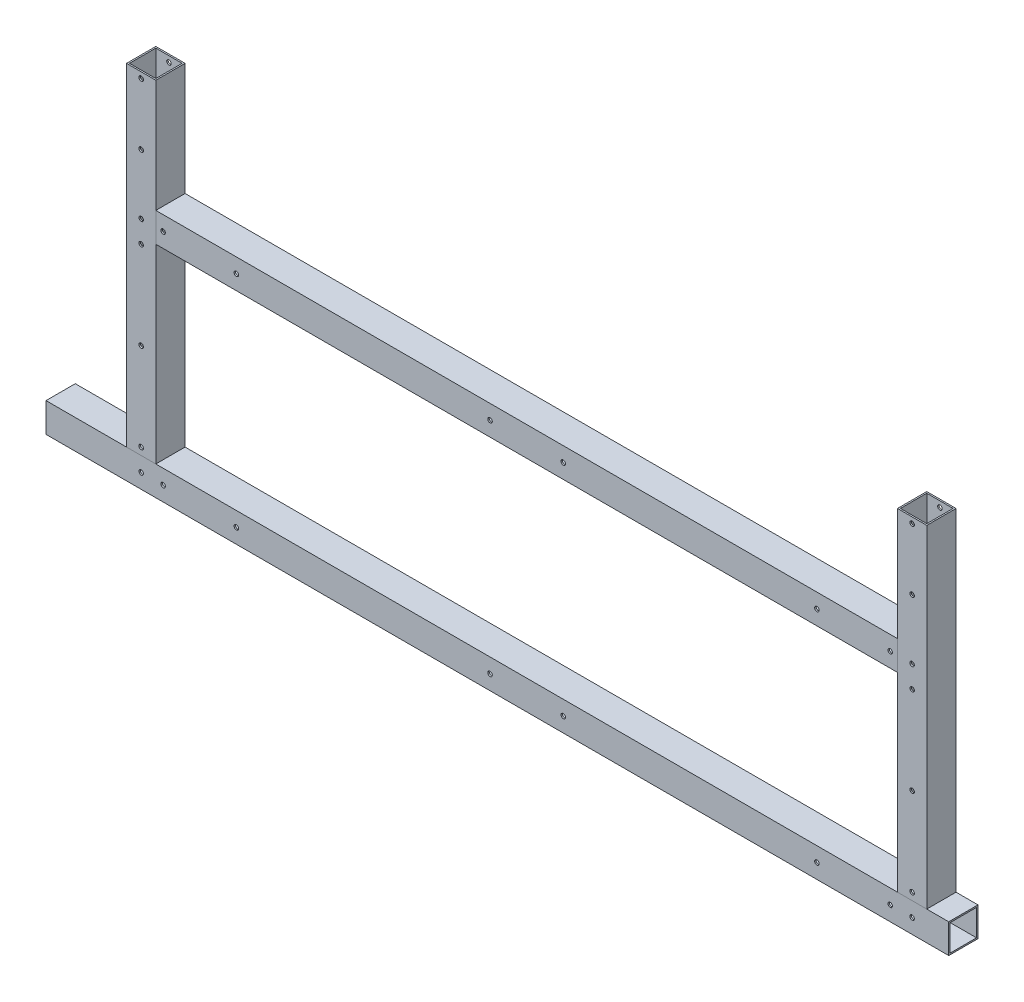
from build123d import *

# Parameters (mm, degrees)
F_20X20X1_1_DEPTH         = 237
F_20X20X1_1_DEPTH_BACK    = 1
SKETCH_1_W                = 20
SKETCH_1_H                = 20
SKETCH_1_W_2              = 18
SKETCH_1_H_2              = 18
SKETCH_1_ON_SEGMENT_2_W   = 20
SKETCH_1_ON_SEGMENT_2_H   = 20
SKETCH_1_ON_SEGMENT_2_W_2 = 18
SKETCH_1_ON_SEGMENT_2_H_2 = 18
F_20X20X1_1_2_DEPTH       = 528.6
SKETCH_1_ON_SEGMENT_3_W   = 20
SKETCH_1_ON_SEGMENT_3_H   = 20
SKETCH_1_ON_SEGMENT_3_W_2 = 18
SKETCH_1_ON_SEGMENT_3_H_2 = 18
F_20X20X1_1_3_DEPTH       = 238
SKETCH_1_ON_SEGMENT_4_W   = 20
SKETCH_1_ON_SEGMENT_4_H   = 20
SKETCH_1_ON_SEGMENT_4_W_2 = 18
SKETCH_1_ON_SEGMENT_4_H_2 = 18
F_20X20X1_1_4_DEPTH       = 616.6
SKETCH_3_R                = 1.55
CUT_EXTRUDE_1_DEPTH       = 601.692566959


with BuildPart() as part:
    # 草图1 → 方形管 20X20X1(1) (new, two sides: drawn at the far end of the back side and taken through both)
    with BuildSketch(Plane(origin=(0, 0, 0), x_dir=(1, 0, 0), z_dir=(0, 1, 0)).offset(-F_20X20X1_1_DEPTH_BACK)):
        Rectangle(SKETCH_1_W, SKETCH_1_H)
        Rectangle(SKETCH_1_W_2, SKETCH_1_H_2, mode=Mode.SUBTRACT)
    extrude(amount=F_20X20X1_1_DEPTH + F_20X20X1_1_DEPTH_BACK)

    # 方形管 20X20X1(1) end butt 1
    split(bisect_by=Plane(origin=(0, 10, 0), x_dir=(-1, 0, 0), z_dir=(0, 1, 0)), keep=Keep.TOP)


with BuildPart() as body_2:
    # 草图1 on segment 2 (carried to segment 2) → 20X20X1_1 2 (new body)
    with BuildSketch(Plane(origin=(-1, 150, 0), x_dir=(0, -1, 0), z_dir=(1, 0, 0))):
        Rectangle(SKETCH_1_ON_SEGMENT_2_W, SKETCH_1_ON_SEGMENT_2_H)
        Rectangle(SKETCH_1_ON_SEGMENT_2_W_2, SKETCH_1_ON_SEGMENT_2_H_2, mode=Mode.SUBTRACT)
    extrude(amount=F_20X20X1_1_2_DEPTH)

    # 20X20X1_1 2 end butt 1
    split(bisect_by=Plane(origin=(10, 150, 0), x_dir=(0, 1, 0), z_dir=(1, 0, 0)), keep=Keep.TOP)

    # 20X20X1_1 2 end butt 2
    split(bisect_by=Plane(origin=(516.6, 150, 0), x_dir=(0, -1, 0), z_dir=(-1, 0, 0)), keep=Keep.TOP)


with BuildPart() as body_3:
    # 草图1 on segment 3 (carried to segment 3) → 20X20X1_1 3 (new body)
    with BuildSketch(Plane(origin=(526.6, -1, 0), x_dir=(1, 0, 0), z_dir=(0, 1, 0))):
        Rectangle(SKETCH_1_ON_SEGMENT_3_W, SKETCH_1_ON_SEGMENT_3_H)
        Rectangle(SKETCH_1_ON_SEGMENT_3_W_2, SKETCH_1_ON_SEGMENT_3_H_2, mode=Mode.SUBTRACT)
    extrude(amount=F_20X20X1_1_3_DEPTH)

    # 20X20X1_1 3 end butt 1
    split(bisect_by=Plane(origin=(526.6, 10, 0), x_dir=(-1, 0, 0), z_dir=(0, 1, 0)), keep=Keep.TOP)


with BuildPart() as body_4:
    # 草图1 on segment 4 (carried to segment 4) → 20X20X1_1 4 (new body)
    with BuildSketch(Plane(origin=(-65, 0, 0), x_dir=(0, -1, 0), z_dir=(1, 0, 0))):
        Rectangle(SKETCH_1_ON_SEGMENT_4_W, SKETCH_1_ON_SEGMENT_4_H)
        Rectangle(SKETCH_1_ON_SEGMENT_4_W_2, SKETCH_1_ON_SEGMENT_4_H_2, mode=Mode.SUBTRACT)
    extrude(amount=F_20X20X1_1_4_DEPTH)


with BuildPart() as cut_extrude_1_tool:
    # 草图3 → 切除-拉伸1 (new, through all)
    with BuildSketch(Plane(origin=(0, 0, -10), x_dir=(-1, 0, 0), z_dir=(0, 0, -1))):
        with Locations(Location((-526.6, 233, 0), (0, 0, 90))):
            Circle(SKETCH_3_R)
        with Locations(Location((-461.6, 150, 0), (0, 0, 90))):
            Circle(SKETCH_3_R)
        with Locations(Location((-511.6, 150, 0), (0, 0, 90))):
            Circle(SKETCH_3_R)
        with Locations(Location((-526.6, 135, 0), (0, 0, 90))):
            Circle(SKETCH_3_R)
        with Locations(Location((-526.6, 150, 0), (0, 0, 90))):
            Circle(SKETCH_3_R)
        with Locations(Location((-526.6, 191, 0), (0, 0, 90))):
            Circle(SKETCH_3_R)
        with Locations(Location((-461.6, 0, 0), (0, 0, 90))):
            Circle(SKETCH_3_R)
        with Locations(Location((-511.6, 0, 0), (0, 0, 90))):
            Circle(SKETCH_3_R)
        with Locations(Location((-526.6, 0, 0), (0, 0, 90))):
            Circle(SKETCH_3_R)
        with Locations(Location((-526.6, 15, 0), (0, 0, 90))):
            Circle(SKETCH_3_R)
        with Locations(Location((-526.6, 75, 0), (0, 0, 90))):
            Circle(SKETCH_3_R)
        with Locations(Location((-238.3, 150, 0), (0, 0, 90))):
            Circle(SKETCH_3_R)
        with Locations(Location((-288.3, 150, 0), (0, 0, 90))):
            Circle(SKETCH_3_R)
        with Locations(Location((0, 75, 0), (0, 0, 90))):
            Circle(SKETCH_3_R)
        with Locations(Location((0, 135, 0), (0, 0, 90))):
            Circle(SKETCH_3_R)
        with Locations(Location((0, 150, 0), (0, 0, 90))):
            Circle(SKETCH_3_R)
        with Locations(Location((-15, 150, 0), (0, 0, 90))):
            Circle(SKETCH_3_R)
        with Locations(Location((-65, 150, 0), (0, 0, 90))):
            Circle(SKETCH_3_R)
        with Locations(Location((-65, 0, 0), (0, 0, 90))):
            Circle(SKETCH_3_R)
        with Locations(Location((-15, 0, 0), (0, 0, 90))):
            Circle(SKETCH_3_R)
        with Locations(Location((0, 0, 0), (0, 0, 90))):
            Circle(SKETCH_3_R)
        with Locations(Location((0, 15, 0), (0, 0, 90))):
            Circle(SKETCH_3_R)
        with Locations(Location((-288.3, 0, 0), (0, 0, 90))):
            Circle(SKETCH_3_R)
        with Locations(Location((-238.3, 0, 0), (0, 0, 90))):
            Circle(SKETCH_3_R)
        with Locations(Location((0, 191, 0), (0, 0, 90))):
            Circle(SKETCH_3_R)
        with Locations(Location((0, 233, 0), (0, 0, 90))):
            Circle(SKETCH_3_R)
    extrude(amount=-CUT_EXTRUDE_1_DEPTH)


with BuildPart() as part_1:
    add(part.part)

    # 切除-拉伸1: cut by cut_extrude_1_tool
    add(cut_extrude_1_tool.part, mode=Mode.SUBTRACT)


with BuildPart() as body_2_1:
    add(body_2.part)

    # 切除-拉伸1: cut by cut_extrude_1_tool
    add(cut_extrude_1_tool.part, mode=Mode.SUBTRACT)


with BuildPart() as body_3_1:
    add(body_3.part)

    # 切除-拉伸1: cut by cut_extrude_1_tool
    add(cut_extrude_1_tool.part, mode=Mode.SUBTRACT)


with BuildPart() as body_4_1:
    add(body_4.part)

    # 切除-拉伸1: cut by cut_extrude_1_tool
    add(cut_extrude_1_tool.part, mode=Mode.SUBTRACT)


solid = Compound([part_1.part, body_2_1.part, body_3_1.part, body_4_1.part])
